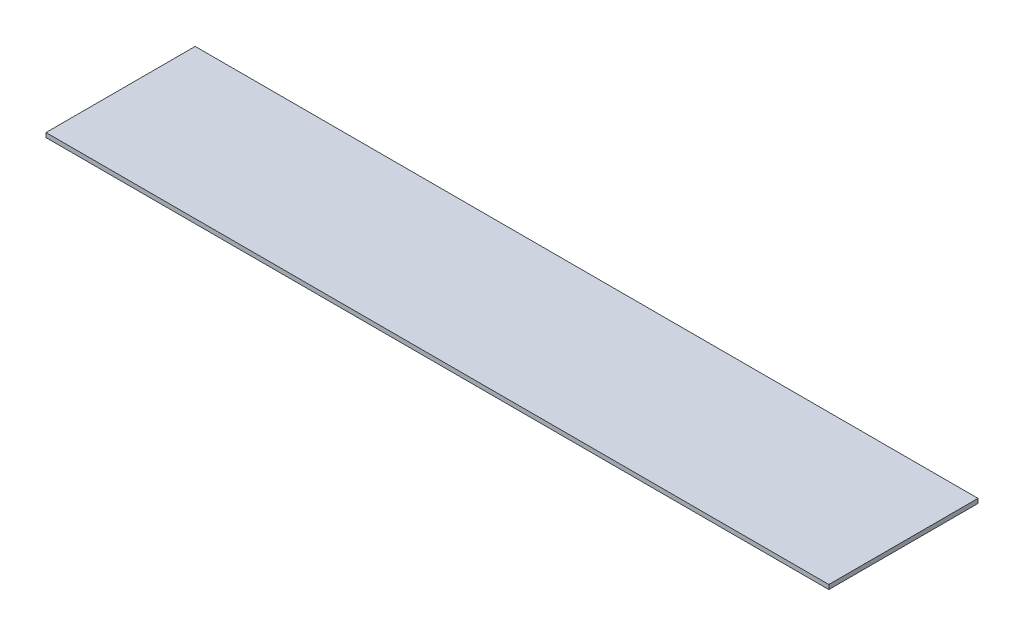
from build123d import *

# Parameters (mm, degrees)
CROQUIS1_W              = 530
CROQUIS1_H              = 101
SALIENTE_EXTRUIR1_DEPTH = 3


with BuildPart() as part:
    # Croquis1 → Saliente-Extruir1 (new body)
    with BuildSketch(Plane(origin=(0, 0, 0), x_dir=(1, 0, 0), z_dir=(0, 1, 0))):
        Rectangle(CROQUIS1_W, CROQUIS1_H)
    extrude(amount=SALIENTE_EXTRUIR1_DEPTH)


solid = part.part
